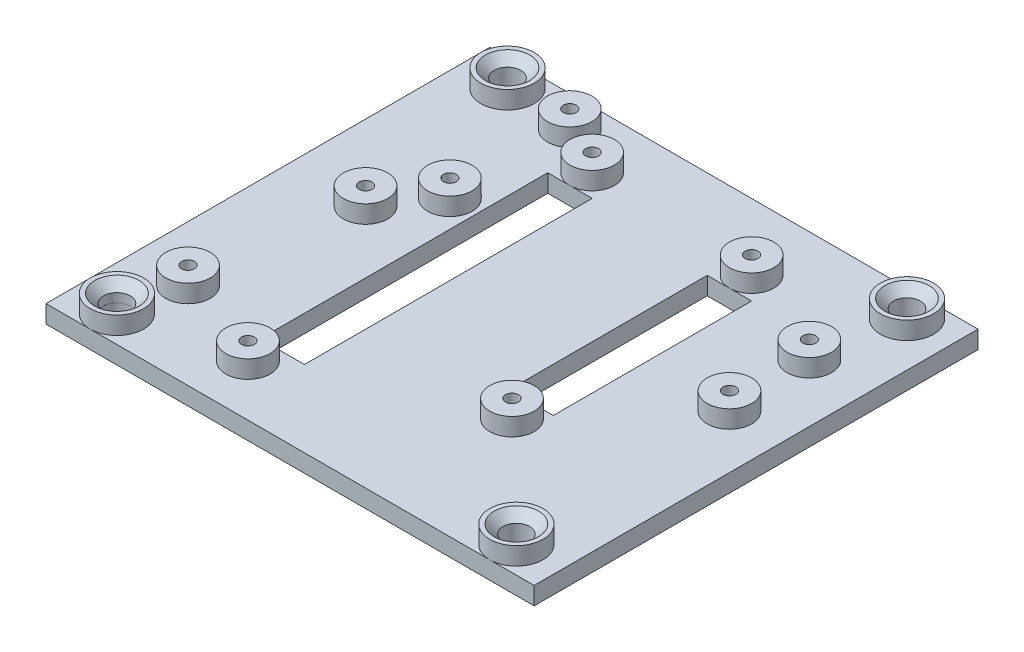
from build123d import *

# Parameters (mm, degrees)
SKETCH_1_R               = 3
EXTRUDE_1_DEPTH          = 4
SKETCH_2_R               = 5
SKETCH_2_R_2             = 1.45
SKETCH_2_R_3             = 6
SKETCH_2_R_4             = 3
SKETCH_2_R_5             = 3.009162644
EXTRUDE_2_DEPTH          = 4
CUT_EXTRUDE_1_DEPTH      = 167.223811286
CUT_EXTRUDE_1_DEPTH_BACK = 167.223811286
SKETCH_2_3_W             = 10
SKETCH_2_3_H             = 64.81813301
SKETCH_2_3_H_2           = 44.688768686
CHAMFER_1_SIZE           = 2


with BuildPart() as part:
    # Эскиз1 → Бобышка-Вытянуть1 (new body)
    with BuildSketch(Plane(origin=(0, 108.938170493, 0), x_dir=(1, 0, 0), z_dir=(0, 1, 0))):
        Polygon((110.264102209, -24.322898947), (110.264102209, -124.322898947), (0.282304198, -124.322898947), (0.282304198, -24.322875098), align=None)
        with Locations((10.264102209, -30.322898947)):
            Circle(SKETCH_1_R, mode=Mode.SUBTRACT)
        with Locations((100.264102209, -30.322898947)):
            Circle(SKETCH_1_R, mode=Mode.SUBTRACT)
        with Locations((100.264102209, -118.322898947)):
            Circle(SKETCH_1_R, mode=Mode.SUBTRACT)
        with Locations((10.264102209, -118.322898947)):
            Circle(SKETCH_1_R, mode=Mode.SUBTRACT)
    extrude(amount=EXTRUDE_1_DEPTH)

    # Эскиз2 → Бобышка-Вытянуть2 (add)
    # profile 1 of 14: a face of its own
    with BuildSketch(Plane(origin=(0, 112.938170493, 0), x_dir=(1, 0, 0), z_dir=(0, 1, 0))):
        with Locations((36.282273297, -37.275706323)):
            Circle(SKETCH_2_R)
        with Locations((36.282273297, -37.275706323)):
            Circle(SKETCH_2_R_2, mode=Mode.SUBTRACT)
    # profile 2 of 14: a face of its own
    with BuildSketch(Plane(origin=(0, 112.938170493, 0), x_dir=(1, 0, 0), z_dir=(0, 1, 0))):
        with Locations((74.264102209, -39.322898947)):
            Circle(SKETCH_2_R)
        with Locations((74.264102209, -39.322898947)):
            Circle(SKETCH_2_R_2, mode=Mode.SUBTRACT)
    # profile 3 of 14: a face of its own
    with BuildSketch(Plane(origin=(0, 112.938170493, 0), x_dir=(1, 0, 0), z_dir=(0, 1, 0))):
        with Locations((25.282304198, -31.322880519)):
            Circle(SKETCH_2_R)
        with Locations((25.282304198, -31.322880519)):
            Circle(SKETCH_2_R_2, mode=Mode.SUBTRACT)
    # profile 4 of 14: a face of its own
    with BuildSketch(Plane(origin=(0, 112.938170493, 0), x_dir=(1, 0, 0), z_dir=(0, 1, 0))):
        with Locations((17.282304198, -69.322875098)):
            Circle(SKETCH_2_R)
        with Locations((17.282304198, -69.322875098)):
            Circle(SKETCH_2_R_2, mode=Mode.SUBTRACT)
    # profile 5 of 14: a face of its own
    with BuildSketch(Plane(origin=(0, 112.938170493, 0), x_dir=(1, 0, 0), z_dir=(0, 1, 0))):
        with Locations((25.282304198, -58.322898947)):
            Circle(SKETCH_2_R)
        with Locations((25.282304198, -58.322898947)):
            Circle(SKETCH_2_R_2, mode=Mode.SUBTRACT)
    # profile 6 of 14: a face of its own
    with BuildSketch(Plane(origin=(0, 112.938170493, 0), x_dir=(1, 0, 0), z_dir=(0, 1, 0))):
        with Locations((12.782304198, -104.822898947)):
            Circle(SKETCH_2_R)
        with Locations((12.782304198, -104.822898947)):
            Circle(SKETCH_2_R_2, mode=Mode.SUBTRACT)
    # profile 7 of 14: a face of its own
    with BuildSketch(Plane(origin=(0, 112.938170493, 0), x_dir=(1, 0, 0), z_dir=(0, 1, 0))):
        with Locations((34.282304198, -112.822898947)):
            Circle(SKETCH_2_R)
        with Locations((34.282304198, -112.822898947)):
            Circle(SKETCH_2_R_2, mode=Mode.SUBTRACT)
    # profile 8 of 14: a face of its own
    with BuildSketch(Plane(origin=(0, 112.938170493, 0), x_dir=(1, 0, 0), z_dir=(0, 1, 0))):
        with Locations((97.264102209, -49.322896128)):
            Circle(SKETCH_2_R)
        with Locations((97.264102209, -49.322896128)):
            Circle(SKETCH_2_R_2, mode=Mode.SUBTRACT)
    # profile 9 of 14: a face of its own
    with BuildSketch(Plane(origin=(0, 112.938170493, 0), x_dir=(1, 0, 0), z_dir=(0, 1, 0))):
        with Locations((98.264102209, -68.322898947)):
            Circle(SKETCH_2_R)
        with Locations((98.264102209, -68.322898947)):
            Circle(SKETCH_2_R_2, mode=Mode.SUBTRACT)
    # profile 10 of 14: a face of its own
    with BuildSketch(Plane(origin=(0, 112.938170493, 0), x_dir=(1, 0, 0), z_dir=(0, 1, 0))):
        with Locations((75.264102209, -94.322898947)):
            Circle(SKETCH_2_R)
        with Locations((75.264102209, -94.322898947)):
            Circle(SKETCH_2_R_2, mode=Mode.SUBTRACT)
    # profile 11 of 14: a face of its own
    with BuildSketch(Plane(origin=(0, 112.938170493, 0), x_dir=(1, 0, 0), z_dir=(0, 1, 0))):
        with Locations((10.264102209, -30.322898947)):
            Circle(SKETCH_2_R_3)
        with Locations((10.264102209, -30.322898947)):
            Circle(SKETCH_2_R_4, mode=Mode.SUBTRACT)
    # profile 12 of 14: a face of its own
    with BuildSketch(Plane(origin=(0, 112.938170493, 0), x_dir=(1, 0, 0), z_dir=(0, 1, 0))):
        with Locations((100.264102209, -30.322898947)):
            Circle(SKETCH_2_R_3)
        with Locations((100.264102209, -30.322898947)):
            Circle(SKETCH_2_R_4, mode=Mode.SUBTRACT)
    # profile 13 of 14: a face of its own
    with BuildSketch(Plane(origin=(0, 112.938170493, 0), x_dir=(1, 0, 0), z_dir=(0, 1, 0))):
        with Locations((100.264102209, -118.322898947)):
            Circle(SKETCH_2_R_3)
        with Locations((100.264102209, -118.322898947)):
            Circle(SKETCH_2_R_4, mode=Mode.SUBTRACT)
    # profile 14 of 14: a face of its own
    with BuildSketch(Plane(origin=(0, 112.938170493, 0), x_dir=(1, 0, 0), z_dir=(0, 1, 0))):
        with Locations((10.264102209, -118.322898947)):
            Circle(SKETCH_2_R_3)
        with Locations((10.264102209, -118.322898947)):
            Circle(SKETCH_2_R_5, mode=Mode.SUBTRACT)
    extrude(amount=EXTRUDE_2_DEPTH)

    # Эскиз2<3> → Вырез-Вытянуть1 (cut, two sides: drawn at the far end of the back side and taken through both)
    with BuildSketch(Plane(origin=(0, 112.938170493, 0), x_dir=(1, 0, 0), z_dir=(0, 1, 0)).offset(-CUT_EXTRUDE_1_DEPTH_BACK)):
        with Locations((36.282273297, -74.684772828)):
            Rectangle(SKETCH_2_3_W, SKETCH_2_3_H)
        with Locations((74.264102209, -66.66728329)):
            Rectangle(SKETCH_2_3_W, SKETCH_2_3_H_2)
    extrude(amount=CUT_EXTRUDE_1_DEPTH + CUT_EXTRUDE_1_DEPTH_BACK, mode=Mode.SUBTRACT)

    # Фаска1
    chamfer_1_edges = [part.edges().sort_by_distance(p)[0] for p in [
        (7.254939564, 116.938170493, 118.322898947),
        (97.264102209, 116.938170493, 118.322898947),
        (97.264102209, 116.938170493, 30.322898947),
        (7.264102209, 116.938170493, 30.322898947),
    ]]
    chamfer(chamfer_1_edges, length=CHAMFER_1_SIZE)


solid = part.part
